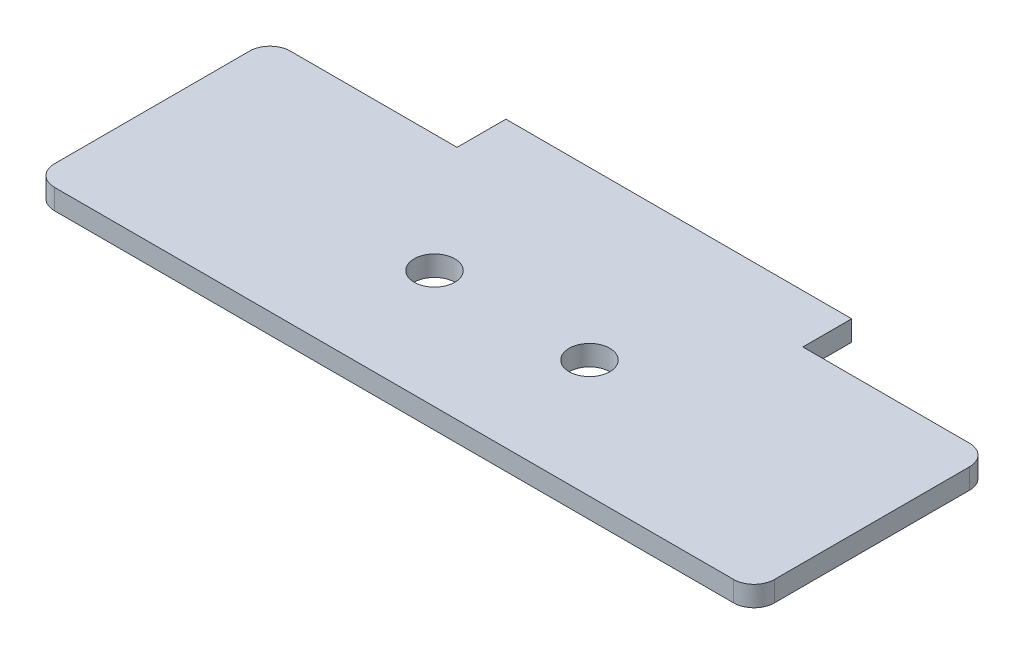
from build123d import *

# Parameters (mm, degrees)
SKETCH1_R           = 0.5
BOSS_EXTRUDE1_DEPTH = 0.5


with BuildPart() as part:
    # Sketch1 → Boss-Extrude1 (new body)
    with BuildSketch(Plane(origin=(0, 0, 0), x_dir=(1, 0, 0), z_dir=(0, 1, 0))):
        with BuildLine():
            Line((6.155, 2.9), (10.255, 2.9))
            ThreePointArc((10.255, 2.9), (10.608553391, 2.753553391), (10.755, 2.4))
            Line((10.755, 2.4), (10.755, -2.4))
            ThreePointArc((10.755, -2.4), (10.608553391, -2.753553391), (10.255, -2.9))
            Line((10.255, -2.9), (-6.445, -2.9))
            ThreePointArc((-6.445, -2.9), (-6.798553391, -2.753553391), (-6.945, -2.4))
            Line((-6.945, -2.4), (-6.945, 2.4))
            ThreePointArc((-6.945, 2.4), (-6.798553391, 2.753553391), (-6.445, 2.9))
            Line((-6.445, 2.9), (-2.345, 2.9))
            Line((-2.345, 2.9), (-2.345, 4.1))
            Line((-2.345, 4.1), (6.155, 4.1))
            Line((6.155, 4.1), (6.155, 2.9))
        make_face()
        with Locations(Location((0, 0, 0), (0, 0, 270))):
            Circle(SKETCH1_R, mode=Mode.SUBTRACT)
        with Locations(Location((3.81, 0, 0), (0, 0, 270))):
            Circle(SKETCH1_R, mode=Mode.SUBTRACT)
    extrude(amount=BOSS_EXTRUDE1_DEPTH)


solid = part.part
